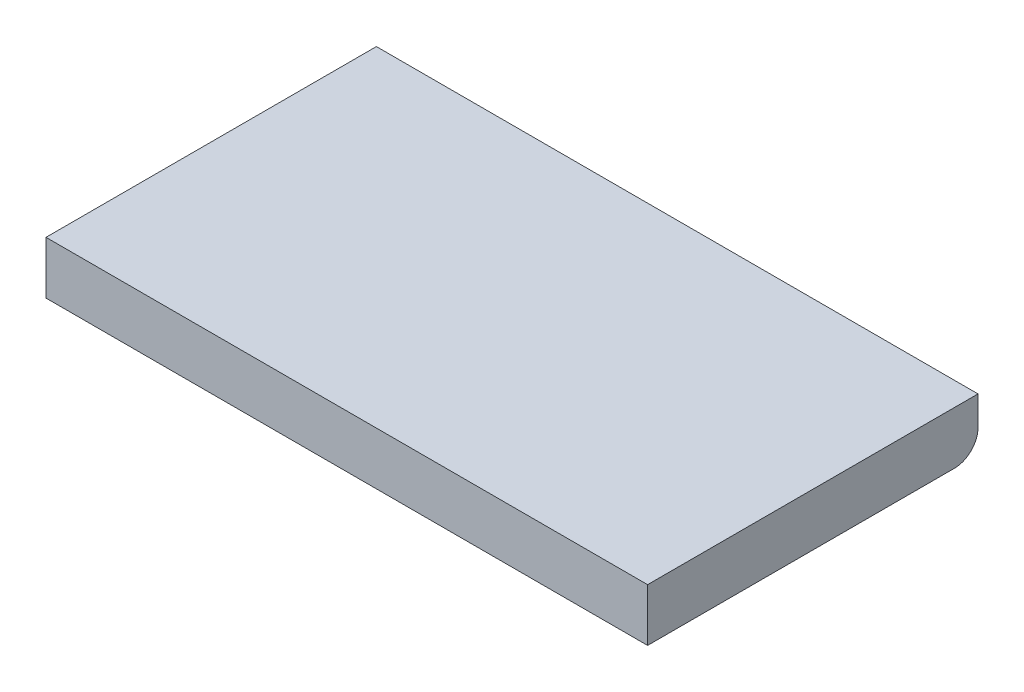
from build123d import *

# Parameters (mm, degrees)
SKETCH2_W           = 653.034
SKETCH2_H           = 358.648
BOSS_EXTRUDE1_DEPTH = 57.15
SKETCH3_W           = 526.034
SKETCH3_H           = 31.75
CUT_EXTRUDE1_DEPTH  = 25.4
SKETCH4_R           = 9.525
BOSS_EXTRUDE2_DEPTH = 25.4
FILLET1_R           = 25.4


with BuildPart() as part:
    # Sketch2 → Boss-Extrude1 (new body)
    with BuildSketch(Plane(origin=(0, 0, 0), x_dir=(1, 0, 0), z_dir=(0, 1, 0))):
        Rectangle(SKETCH2_W, SKETCH2_H)
    extrude(amount=BOSS_EXTRUDE1_DEPTH)

    # Sketch3 → Cut-Extrude1 (cut)
    with BuildSketch(Plane(origin=(0, 0, -179.324), x_dir=(-1, 0, 0), z_dir=(0, 0, -1))):
        with Locations((0, 15.875)):
            Rectangle(SKETCH3_W, SKETCH3_H)
    extrude(amount=-CUT_EXTRUDE1_DEPTH, mode=Mode.SUBTRACT)

    # Sketch4 → Boss-Extrude2 (add)
    with BuildSketch(Plane.ZY.offset(-263.017)):
        with Locations(Location((-165.585268519, 17.143786042, 0), (0, 0, 180))):
            Circle(SKETCH4_R)
    boss_extrude2 = extrude(amount=BOSS_EXTRUDE2_DEPTH)

    # Mirror1: Boss-Extrude2 across plane
    add(boss_extrude2.mirror(Plane.ZY))

    # Fillet1
    fillet1_edges = [part.edges().sort_by_distance(p)[0] for p in [
        (-294.767, 0, -179.324),
        (294.767, 0, -179.324),
    ]]
    fillet(fillet1_edges, radius=FILLET1_R)


solid = part.part
